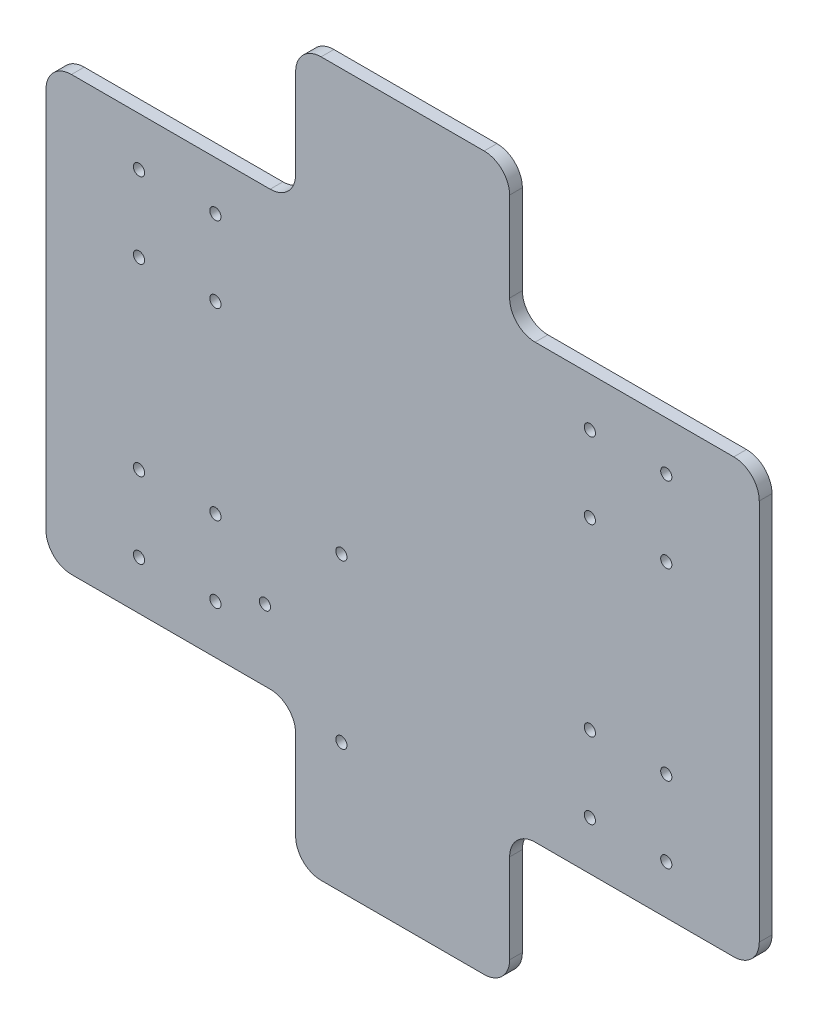
from build123d import *

# Parameters (mm, degrees)
SKETCH_1_R          = 2.2
EXTRUDE_1_DEPTH     = 5
FILLET_1_R          = 10
CUT_EXTRUDE_1_REACH = 317.85
SKETCH_2_R          = 2.2


with BuildPart() as part:
    # 草图1 → 凸台-拉伸1 (new body)
    with BuildSketch(Plane.XY):
        Polygon((-51.5, 7), (-51.5, -163), (46.5, -163), (46.5, -218), (130.5, -218), (130.5, -163), (228.5, -163), (228.5, 7), (130.5, 7), (130.5, 62), (46.5, 62), (46.5, 7), align=None)
        with Locations((-15, -143.9)):
            Circle(SKETCH_1_R, mode=Mode.SUBTRACT)
        with Locations((15, -143.9)):
            Circle(SKETCH_1_R, mode=Mode.SUBTRACT)
        with Locations((-15, -114.1)):
            Circle(SKETCH_1_R, mode=Mode.SUBTRACT)
        with Locations((15, -114.1)):
            Circle(SKETCH_1_R, mode=Mode.SUBTRACT)
        with Locations((162, -143.9)):
            Circle(SKETCH_1_R, mode=Mode.SUBTRACT)
        with Locations((192, -143.9)):
            Circle(SKETCH_1_R, mode=Mode.SUBTRACT)
        with Locations((162, -114.1)):
            Circle(SKETCH_1_R, mode=Mode.SUBTRACT)
        with Locations((192, -114.1)):
            Circle(SKETCH_1_R, mode=Mode.SUBTRACT)
        with Locations((-15, -41.9)):
            Circle(SKETCH_1_R, mode=Mode.SUBTRACT)
        with Locations((15, -41.9)):
            Circle(SKETCH_1_R, mode=Mode.SUBTRACT)
        with Locations((-15, -12.1)):
            Circle(SKETCH_1_R, mode=Mode.SUBTRACT)
        with Locations((15, -12.1)):
            Circle(SKETCH_1_R, mode=Mode.SUBTRACT)
        with Locations((162, -41.9)):
            Circle(SKETCH_1_R, mode=Mode.SUBTRACT)
        with Locations((192, -41.9)):
            Circle(SKETCH_1_R, mode=Mode.SUBTRACT)
        with Locations((162, -12.1)):
            Circle(SKETCH_1_R, mode=Mode.SUBTRACT)
        with Locations((192, -12.1)):
            Circle(SKETCH_1_R, mode=Mode.SUBTRACT)
    extrude(amount=EXTRUDE_1_DEPTH)

    # 圆角1
    fillet_1_edges = [part.edges().sort_by_distance(p)[0] for p in [
        (130.5, 7, 2.5),
        (228.5, 7, 2.5),
        (228.5, -163, 2.5),
        (130.5, -163, 2.5),
        (130.5, -218, 2.5),
        (46.5, -218, 2.5),
        (46.5, -163, 2.5),
        (-51.5, -163, 2.5),
        (-51.5, 7, 2.5),
        (46.5, 7, 2.5),
        (46.5, 62, 2.5),
        (130.5, 62, 2.5),
    ]]
    fillet(fillet_1_edges, radius=FILLET_1_R)

    # 草图2 → 切除-拉伸1 (cut, up to next)
    with BuildSketch(Plane(origin=(0, 0, 0), x_dir=(-1, 0, 0), z_dir=(0, 0, -1)), mode=Mode.PRIVATE) as cut_extrude_1_sk1:
        with Locations(Location((-64.458980338, -103.063390978, 0), (0, 0, 90))):
            Circle(SKETCH_2_R)
    cut_extrude_1_tool1 = extrude(cut_extrude_1_sk1.sketch, amount=-CUT_EXTRUDE_1_REACH, mode=Mode.PRIVATE) & part.part
    # 草图2 → 切除-拉伸1 (cut, up to next)
    with BuildSketch(Plane(origin=(0, 0, 0), x_dir=(-1, 0, 0), z_dir=(0, 0, -1)), mode=Mode.PRIVATE) as cut_extrude_1_sk2:
        with Locations(Location((-34.458980337, -135.063390978, 0), (0, 0, 90))):
            Circle(SKETCH_2_R)
    cut_extrude_1_tool2 = extrude(cut_extrude_1_sk2.sketch, amount=-CUT_EXTRUDE_1_REACH, mode=Mode.PRIVATE) & part.part
    # 草图2 → 切除-拉伸1 (cut, up to next)
    with BuildSketch(Plane(origin=(0, 0, 0), x_dir=(-1, 0, 0), z_dir=(0, 0, -1)), mode=Mode.PRIVATE) as cut_extrude_1_sk3:
        with Locations(Location((-64.458980338, -167.063390978, 0), (0, 0, 90))):
            Circle(SKETCH_2_R)
    cut_extrude_1_tool3 = extrude(cut_extrude_1_sk3.sketch, amount=-CUT_EXTRUDE_1_REACH, mode=Mode.PRIVATE) & part.part
    add(cut_extrude_1_tool1.solids().sort_by_distance((64.45898, -103.063391, 0))[0], mode=Mode.SUBTRACT)
    add(cut_extrude_1_tool2.solids().sort_by_distance((34.45898, -135.063391, 0))[0], mode=Mode.SUBTRACT)
    add(cut_extrude_1_tool3.solids().sort_by_distance((64.45898, -167.063391, 0))[0], mode=Mode.SUBTRACT)


solid = part.part
